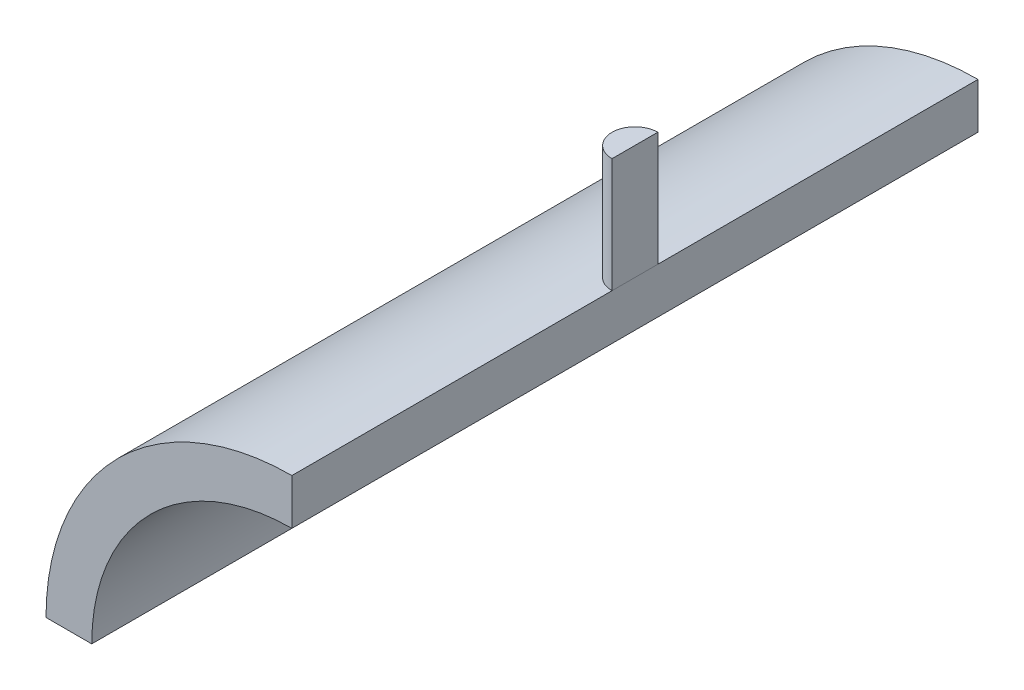
from build123d import *

# Parameters (mm, degrees)
BOSS_EXTRUDE1_DEPTH                  = 76.2
BOSS_EXTRUDE2_DEPTH                  = 12.7
BOSS_EXTRUDE2_DIRECTION_2_REACH      = 87.426
BOSS_EXTRUDE2_DIRECTION_2_END_RADIUS = 27.305


with BuildPart() as part:
    # Sketch1 → Boss-Extrude1 (new body)
    with BuildSketch(Plane.XY):
        with BuildLine():
            Line((-27.305, 0), (-22.225, 0))
            ThreePointArc((-22.225, 0), (-15.715448212, 15.715448212), (0, 22.225))
            Line((0, 22.225), (0, 27.305))
            ThreePointArc((0, 27.305), (-19.30755066, 19.30755066), (-27.305, 0))
        make_face()
    extrude(amount=BOSS_EXTRUDE1_DEPTH)


with BuildPart() as body_2:
    # Sketch2 → Boss-Extrude2 (new body)
    with BuildSketch(Plane(origin=(0, 27.305, 0), x_dir=(1, 0, 0), z_dir=(0, 1, 0))):
        with BuildLine():
            Line((0, -35.56), (0, -40.64))
            ThreePointArc((0, -40.64), (-2.54, -38.1), (0, -35.56))
        make_face()
    extrude(amount=BOSS_EXTRUDE2_DEPTH)

    # Boss-Extrude2 direction 2: up to this cylinder (the profile starts outside it)
    boss_extrude2_direction_2_end = Plane(origin=(0, 0, 38.1), z_dir=(0, 0, -1)) * Cylinder(BOSS_EXTRUDE2_DIRECTION_2_END_RADIUS, 230.462, mode=Mode.PRIVATE)
    # Sketch2 → Boss-Extrude2 direction 2 (add, up to the surface)
    with BuildSketch(Plane(origin=(0, 27.305, 0), x_dir=(1, 0, 0), z_dir=(0, 1, 0)), mode=Mode.PRIVATE) as boss_extrude2_direction_2_sk1:
        with BuildLine():
            Line((0, -35.56), (0, -40.64))
            ThreePointArc((0, -40.64), (-2.54, -38.1), (0, -35.56))
        make_face()
    boss_extrude2_direction_2_tool1 = extrude(boss_extrude2_direction_2_sk1.sketch, amount=-BOSS_EXTRUDE2_DIRECTION_2_REACH, mode=Mode.PRIVATE) - boss_extrude2_direction_2_end
    add(boss_extrude2_direction_2_tool1.solids().sort_by_distance((-1.078009, 27.305, 38.1))[0])


solid = Compound([part.part, body_2.part])
